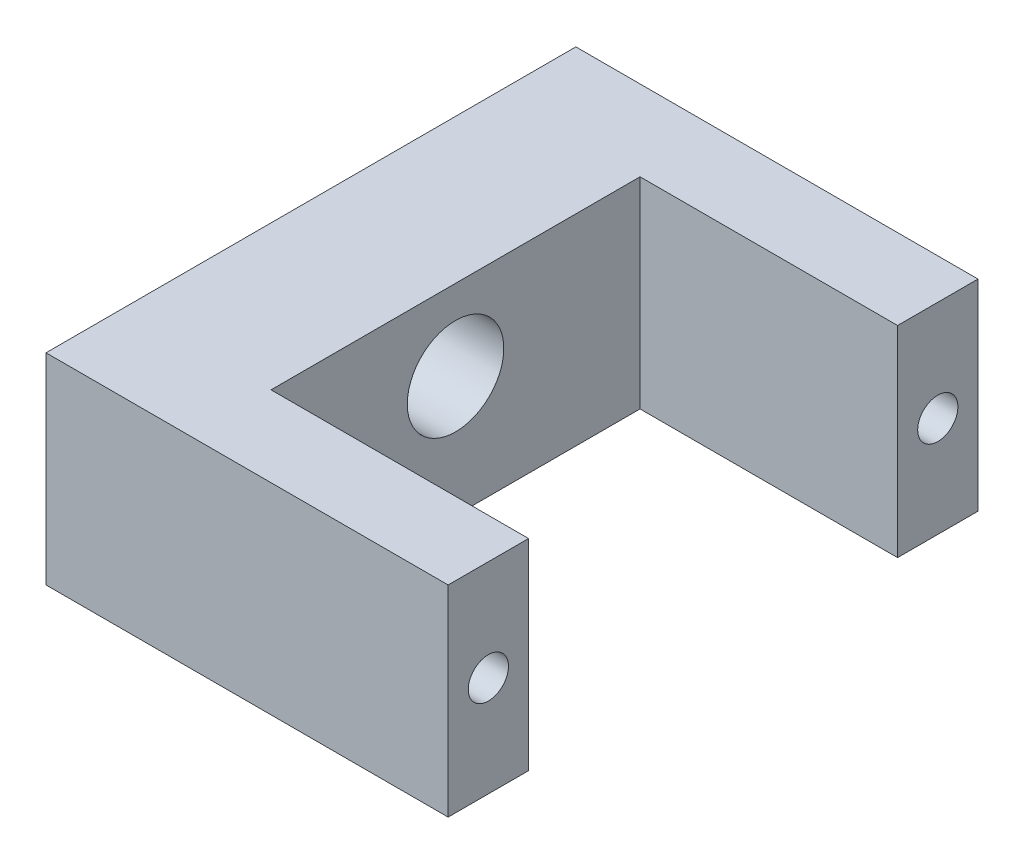
from build123d import *

# Parameters (mm, degrees)
Y_KSEKLIK_EKSTR_ZYON1_DEPTH = 6.25
IZIM2_R                     = 1.25
KES_EKSTR_ZYON1_DEPTH       = 12.5
IZIM4_R                     = 3
KES_EKSTR_ZYON2_DEPTH       = 10


with BuildPart() as part:
    # Çizim1 → Yükseklik-Ekstrüzyon1 (new, symmetric)
    with BuildSketch(Plane(origin=(0, 0, 0), x_dir=(1, 0, 0), z_dir=(0, 1, 0))):
        Polygon((0, 0), (0, 32.94), (25, 32.94), (25, 27.94), (8.99, 27.94), (8.99, 5), (25, 5), (25, 0), align=None)
    extrude(amount=Y_KSEKLIK_EKSTR_ZYON1_DEPTH, both=True)

    # Çizim2 → Kes-Ekstrüzyon1 (cut)
    with BuildSketch(Plane(origin=(25, 0, 0), x_dir=(0, 0, -1), z_dir=(1, 0, 0))):
        with Locations((2.5, 0)):
            Circle(IZIM2_R)
    kes_ekstr_zyon1 = extrude(amount=-KES_EKSTR_ZYON1_DEPTH, mode=Mode.SUBTRACT)

    # Aynalama1: Kes-Ekstrüzyon1 across plane
    add(kes_ekstr_zyon1.mirror(Plane.XY.offset(-16.47)), mode=Mode.SUBTRACT)

    # Çizim4 → Kes-Ekstrüzyon2 (cut)
    with BuildSketch(Plane.ZY):
        with Locations((-16.47, 1.25)):
            Circle(IZIM4_R)
    extrude(amount=-KES_EKSTR_ZYON2_DEPTH, mode=Mode.SUBTRACT)


solid = part.part
